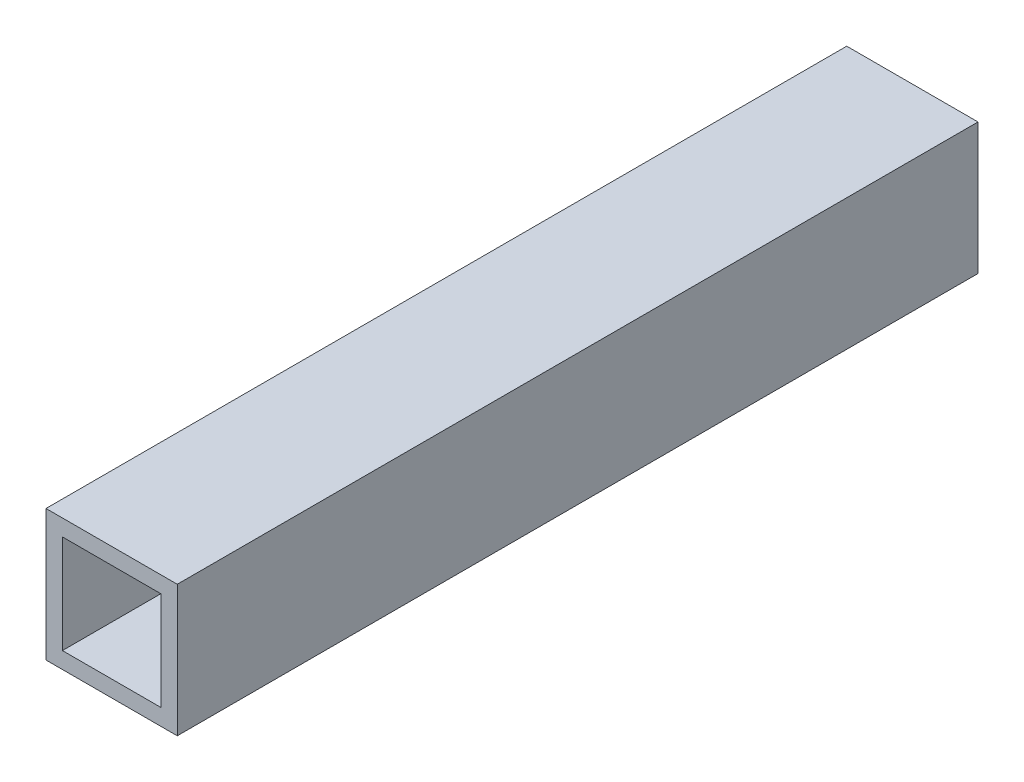
from build123d import *

# Parameters (mm, degrees)
SKETCH1_W           = 25.4
SKETCH1_H           = 25.4
SKETCH1_W_2         = 19.05
SKETCH1_H_2         = 19.05
BOSS_EXTRUDE1_DEPTH = 154.94


with BuildPart() as part:
    # Sketch1 → Boss-Extrude1 (new body)
    with BuildSketch(Plane.XY):
        with Locations((-12.7, 12.7)):
            Rectangle(SKETCH1_W, SKETCH1_H)
        with Locations((-12.7, 12.7)):
            Rectangle(SKETCH1_W_2, SKETCH1_H_2, mode=Mode.SUBTRACT)
    extrude(amount=BOSS_EXTRUDE1_DEPTH)


solid = part.part
